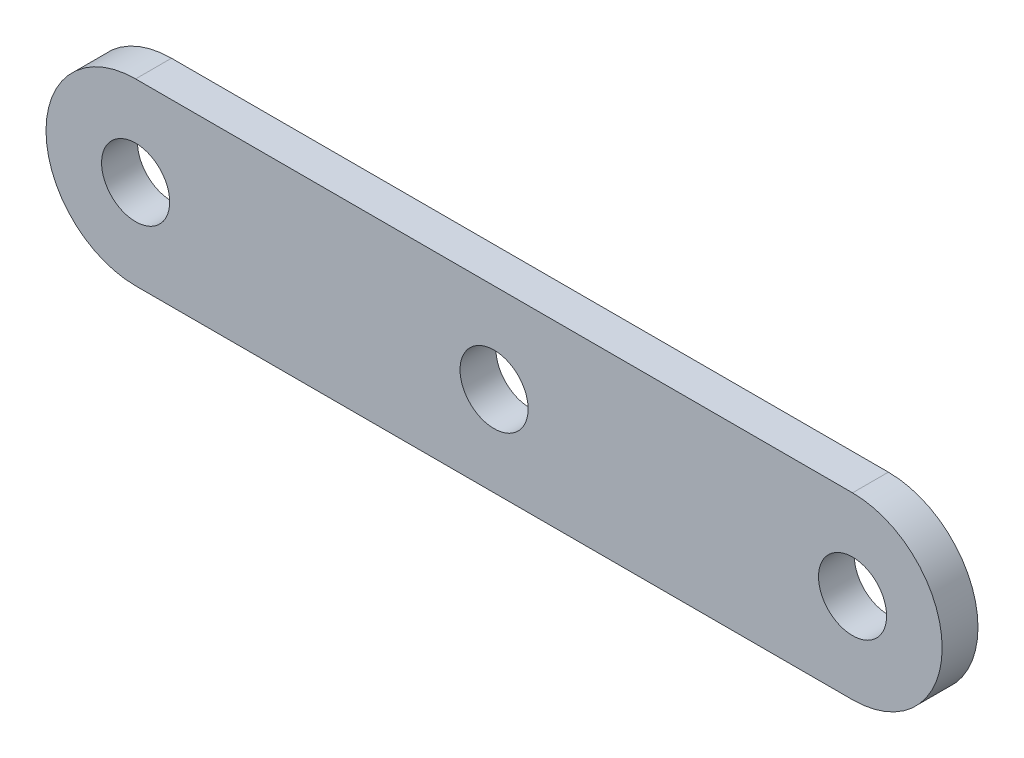
from build123d import *

# Parameters (mm, degrees)
CROQUIS1_R              = 2.413
SALIENTE_EXTRUIR1_DEPTH = 1.27


with BuildPart() as part:
    # Croquis1 → Saliente-Extruir1 (new, symmetric)
    with BuildSketch(Plane.XY):
        with BuildLine():
            Line((25.4, -4.841253264), (-25.4, -4.841253264))
            ThreePointArc((-25.4, -4.841253264), (-31.75, 1.508746736), (-25.4, 7.858746736))
            Line((-25.4, 7.858746736), (25.4, 7.858746736))
            ThreePointArc((25.4, 7.858746736), (31.75, 1.508746736), (25.4, -4.841253264))
        make_face()
        with Locations((-25.4, 1.508746736)):
            Circle(CROQUIS1_R, mode=Mode.SUBTRACT)
        with Locations((0, 1.508746736)):
            Circle(CROQUIS1_R, mode=Mode.SUBTRACT)
        with Locations((25.4, 1.508746736)):
            Circle(CROQUIS1_R, mode=Mode.SUBTRACT)
    extrude(amount=SALIENTE_EXTRUIR1_DEPTH, both=True)


solid = part.part
